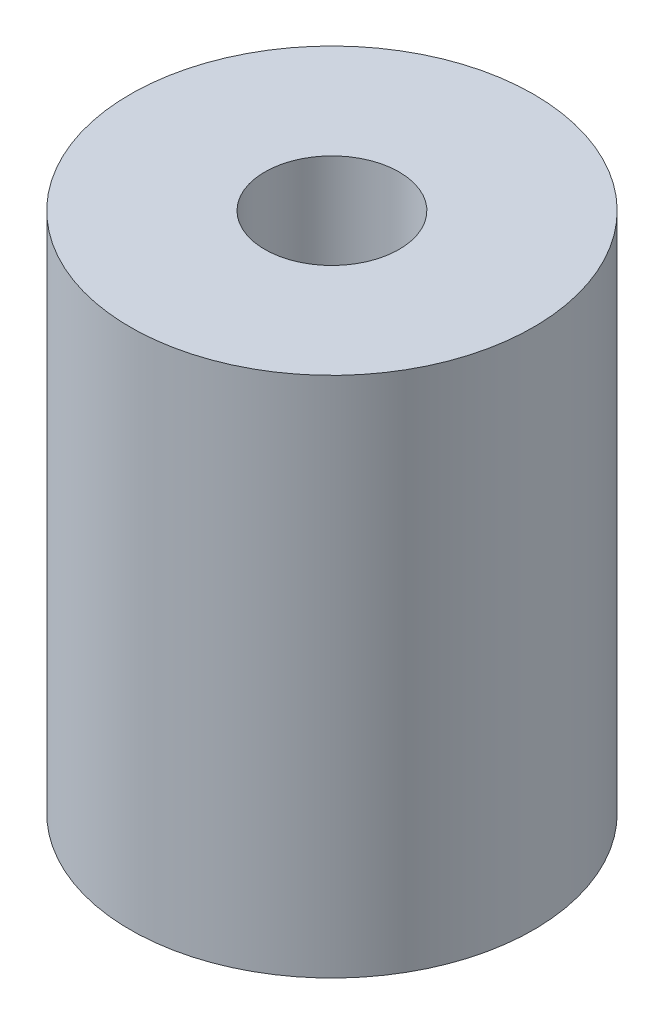
from build123d import *

# Parameters (mm, degrees)
SKETCH2_R           = 6.0071
SKETCH2_R_2         = 2.00025
BOSS_EXTRUDE1_DEPTH = 7.7724


with BuildPart() as part:
    # Sketch2 → Boss-Extrude1 (new, symmetric)
    with BuildSketch(Plane(origin=(0, 0, 0), x_dir=(1, 0, 0), z_dir=(0, 1, 0))):
        with Locations(Location((10.139718263, -0.788352622, 0), (0, 0, 90))):
            Circle(SKETCH2_R)
        with Locations(Location((10.139718263, -0.788352622, 0), (0, 0, 90))):
            Circle(SKETCH2_R_2, mode=Mode.SUBTRACT)
    extrude(amount=BOSS_EXTRUDE1_DEPTH, both=True)


solid = part.part
